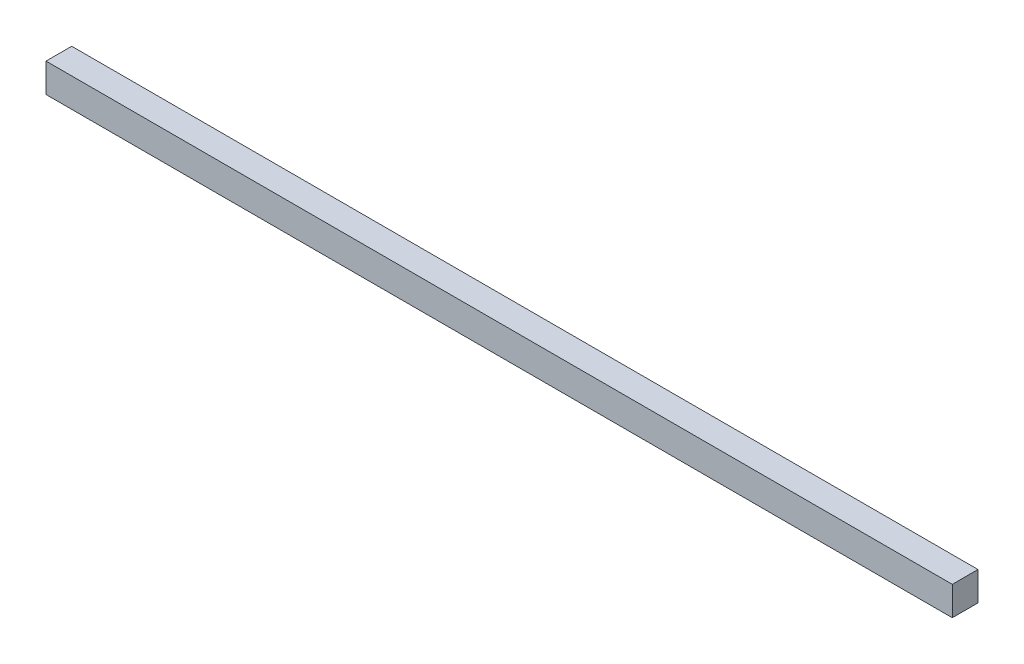
from build123d import *

# Parameters (mm, degrees)
SKETCH_1_W      = 705.188880495
SKETCH_1_H      = 22.531659257
EXTRUDE_1_DEPTH = 20


with BuildPart() as part:
    # Эскиз1 → Бобышка-Вытянуть1 (new body)
    with BuildSketch(Plane.XY):
        with Locations((279.952091829, 11.265829629)):
            Rectangle(SKETCH_1_W, SKETCH_1_H)
    extrude(amount=EXTRUDE_1_DEPTH)


solid = part.part
